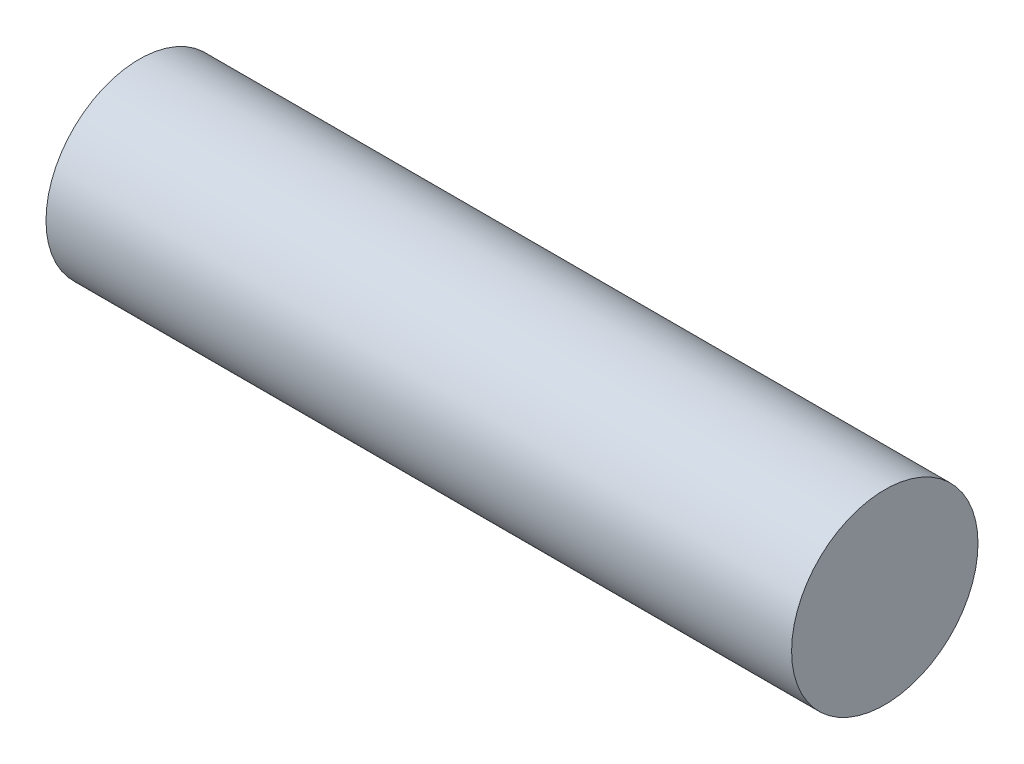
from build123d import *

# Parameters (mm, degrees)
SKETCH1_W           = 20
SKETCH1_H           = 3.75
BOSS_EXTRUDE2_START = 10
SKETCH3_R           = 3.75
BOSS_EXTRUDE2_DEPTH = 10


with BuildPart() as part:
    # Sketch1 → Revolve1 (revolve)
    with BuildSketch(Plane.XY, mode=Mode.PRIVATE) as revolve1_sk:
        with Locations((10, 1.875)):
            Rectangle(SKETCH1_W, SKETCH1_H)
    revolve(revolve1_sk.sketch.rotate(Axis((0, 0, 0), (-1, 0, 0)), 90), axis=Axis((0, 0, 0), (-1, 0, 0)))

    # Sketch3 → Boss-Extrude2 (add)
    with BuildSketch(Plane.ZY.offset(BOSS_EXTRUDE2_START)):
        with Locations(Location((0, 0, 0), (0, 0, 180))):
            Circle(SKETCH3_R)
    extrude(amount=-BOSS_EXTRUDE2_DEPTH)


solid = part.part
